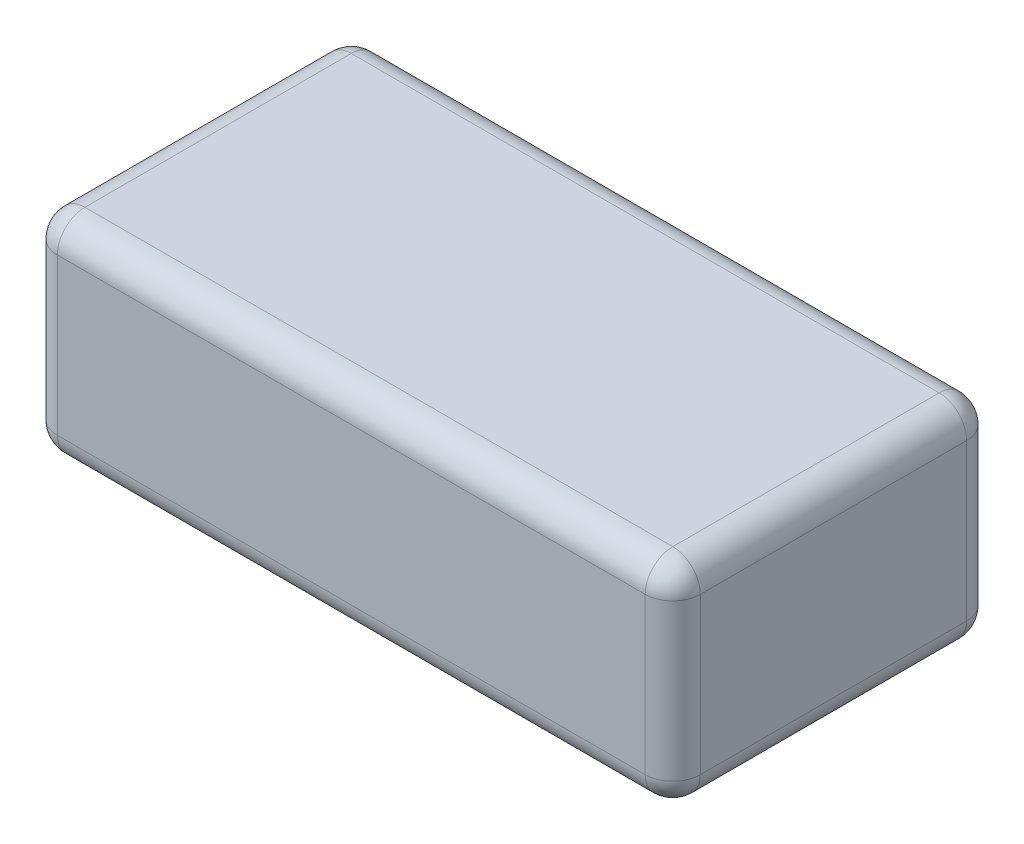
from build123d import *

# Parameters (mm, degrees)
SKETCH1_W           = 70
SKETCH1_H           = 23
BOSS_EXTRUDE1_DEPTH = 17.5
FILLET1_R           = 3


with BuildPart() as part:
    # Sketch1 → Boss-Extrude1 (new, symmetric)
    with BuildSketch(Plane.XY):
        Rectangle(SKETCH1_W, SKETCH1_H)
    extrude(amount=BOSS_EXTRUDE1_DEPTH, both=True)

    # Fillet1
    fillet1_edges = [part.edges().sort_by_distance(p)[0] for p in [
        (0, 11.5, 17.5),
        (-35, 0, 17.5),
        (0, -11.5, 17.5),
        (-35, 0, -17.5),
        (0, 11.5, -17.5),
        (35, 0, -17.5),
        (0, -11.5, -17.5),
        (35, 0, 17.5),
        (-35, -11.5, 0),
        (-35, 11.5, 0),
        (35, 11.5, 0),
        (35, -11.5, 0),
    ]]
    fillet(fillet1_edges, radius=FILLET1_R)


solid = part.part
